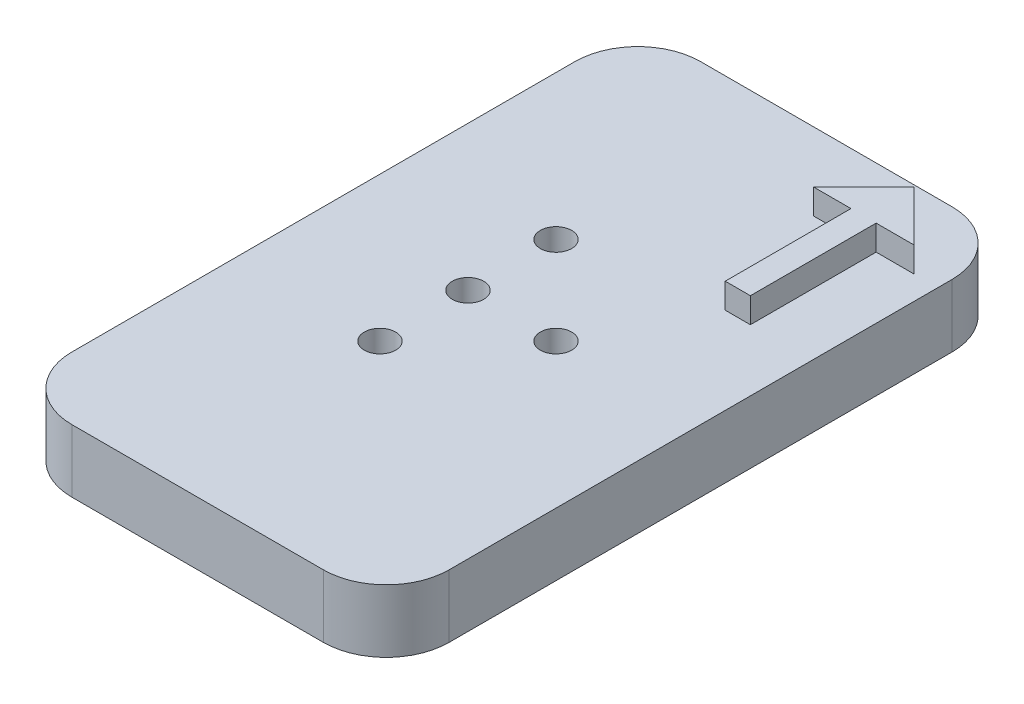
from build123d import *

# Parameters (mm, degrees)
SKETCH1_W           = 30
SKETCH1_H           = 50
SKETCH1_R           = 1.25
BOSS_EXTRUDE1_DEPTH = 5
FILLET1_R           = 5
BOSS_EXTRUDE2_DEPTH = 2


with BuildPart() as part:
    # Sketch1 → Boss-Extrude1 (new body)
    with BuildSketch(Plane(origin=(0, 0, 0), x_dir=(1, 0, 0), z_dir=(0, 1, 0))):
        with Locations((3.5, 0)):
            Rectangle(SKETCH1_W, SKETCH1_H)
        with Locations(Location((0, 0, 0), (0, 0, 270))):
            Circle(SKETCH1_R, mode=Mode.SUBTRACT)
        with Locations(Location((0, 7, 0), (0, 0, 270))):
            Circle(SKETCH1_R, mode=Mode.SUBTRACT)
        with Locations(Location((7, 0, 0), (0, 0, 270))):
            Circle(SKETCH1_R, mode=Mode.SUBTRACT)
        with Locations(Location((0, -7, 0), (0, 0, 270))):
            Circle(SKETCH1_R, mode=Mode.SUBTRACT)
    extrude(amount=BOSS_EXTRUDE1_DEPTH)

    # Fillet1
    fillet1_edges = [part.edges().sort_by_distance(p)[0] for p in [
        (-11.5, 2.5, -25),
        (18.5, 2.5, -25),
        (18.5, 2.5, 25),
        (-11.5, 2.5, 25),
    ]]
    fillet(fillet1_edges, radius=FILLET1_R)

    # Sketch2 → Boss-Extrude2 (add)
    with BuildSketch(Plane(origin=(0, 5, 0), x_dir=(1, 0, 0), z_dir=(0, 1, 0))):
        Polygon((11.600813037, 18.856220698), (11.600813037, 8.856220698), (13.600813037, 8.856220698), (13.600813037, 18.856220698), (16.600813037, 18.856220698), (12.600813037, 22.856220698), (8.600813037, 18.856220698), align=None)
    extrude(amount=BOSS_EXTRUDE2_DEPTH)


solid = part.part
